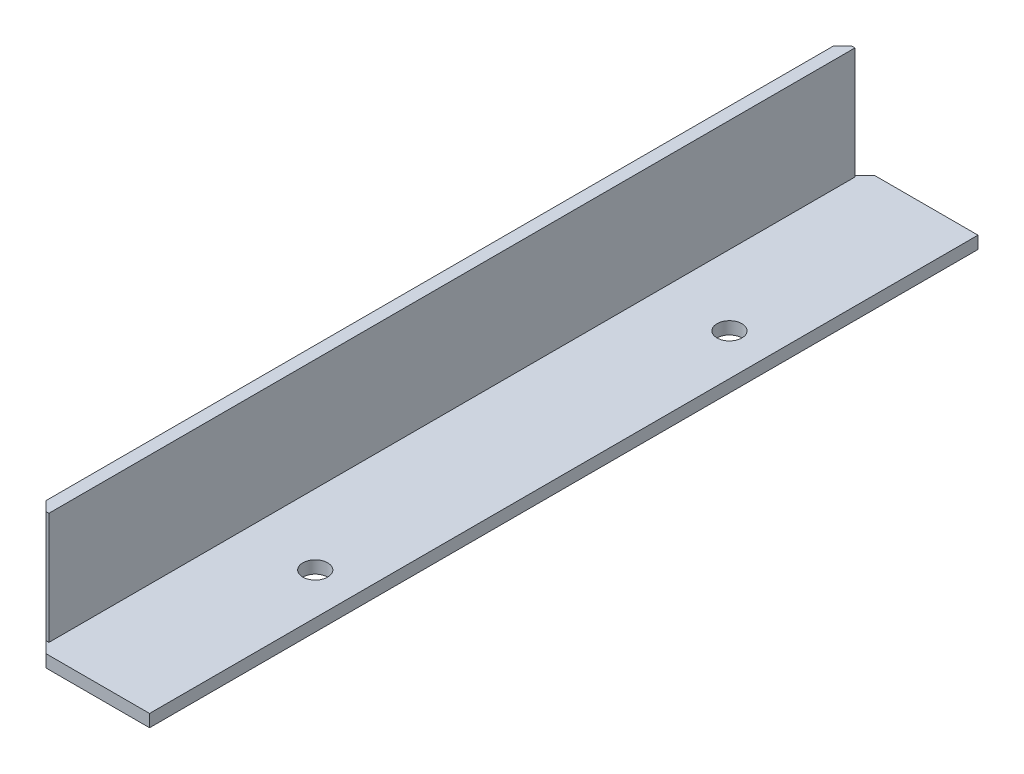
from build123d import *
from OCP.BRepFilletAPI import BRepFilletAPI_MakeChamfer

# Parameters (mm, degrees)
EXTRUSION1_DEPTH           = 100
ESQUISSE2_R                = 1.5
EXTRUSION2_DEPTH           = 100
R_P_TITION_LIN_AIRE1_COUNT = 2
R_P_TITION_LIN_AIRE1_PITCH = 50
CHANFREIN1_SIZE            = 2.5
CHANFREIN3_SIZE            = 0.5
CHANFREIN3_SIZE2           = 0.353553391


with BuildPart() as part:
    # Esquisse1 → Extrusion1 (new body)
    with BuildSketch(Plane.XY):
        Polygon((0, 0), (1.5, 0), (15, 0), (15, 1.5), (1.5, 1.5), (1.5, 15), (0, 15), align=None)
    extrude(amount=EXTRUSION1_DEPTH)

    # Esquisse2 → Extrusion2 (cut)
    with BuildSketch(Plane.XZ):
        with Locations(Location((10, 75, 0), (0, 0, 270))):
            Circle(ESQUISSE2_R)
    extrusion2 = extrude(amount=-EXTRUSION2_DEPTH, mode=Mode.SUBTRACT)

    # Répétition linéaire1: Extrusion2 ×2
    with Locations(*[(0, 0, -i * R_P_TITION_LIN_AIRE1_PITCH) for i in range(1, R_P_TITION_LIN_AIRE1_COUNT)]):
        add(extrusion2, mode=Mode.SUBTRACT)

    # Chanfrein1
    chanfrein1_edges = [part.edges().sort_by_distance(p)[0] for p in [
        (0, 7.5, 100),
        (0, 7.5, 0),
    ]]
    chamfer(chanfrein1_edges, length=CHANFREIN1_SIZE)

    # Chanfrein3: one chamfer whose edges measure the first distance from different faces: ONE call of the kernel's chamfer builder (chamfer() names one face for all edges)
    chanfrein3_edges_1 = [part.edges().sort_by_distance(p)[0] for p in [
        (1.5, 8.25, 1),
    ]]
    chanfrein3_side_1 = [part.faces().sort_by_distance(p)[0] for p in [
        (0.828125, 7.078125, 1.671875),
    ]]
    chanfrein3_edges_2 = [part.edges().sort_by_distance(p)[0] for p in [
        (1.5, 8.25, 99),
    ]]
    chanfrein3_side_2 = [part.faces().sort_by_distance(p)[0] for p in [
        (0.828125, 7.078125, 98.328125),
    ]]
    chanfrein3 = BRepFilletAPI_MakeChamfer(part.part.solid().wrapped)
    for e in chanfrein3_edges_1:
        chanfrein3.Add(CHANFREIN3_SIZE, CHANFREIN3_SIZE2, e.wrapped, chanfrein3_side_1[0].wrapped)  # the first distance lies on this face
    for e in chanfrein3_edges_2:
        chanfrein3.Add(CHANFREIN3_SIZE, CHANFREIN3_SIZE2, e.wrapped, chanfrein3_side_2[0].wrapped)  # the first distance lies on this face
    add(Compound.cast(chanfrein3.Shape()), mode=Mode.REPLACE)


solid = part.part
